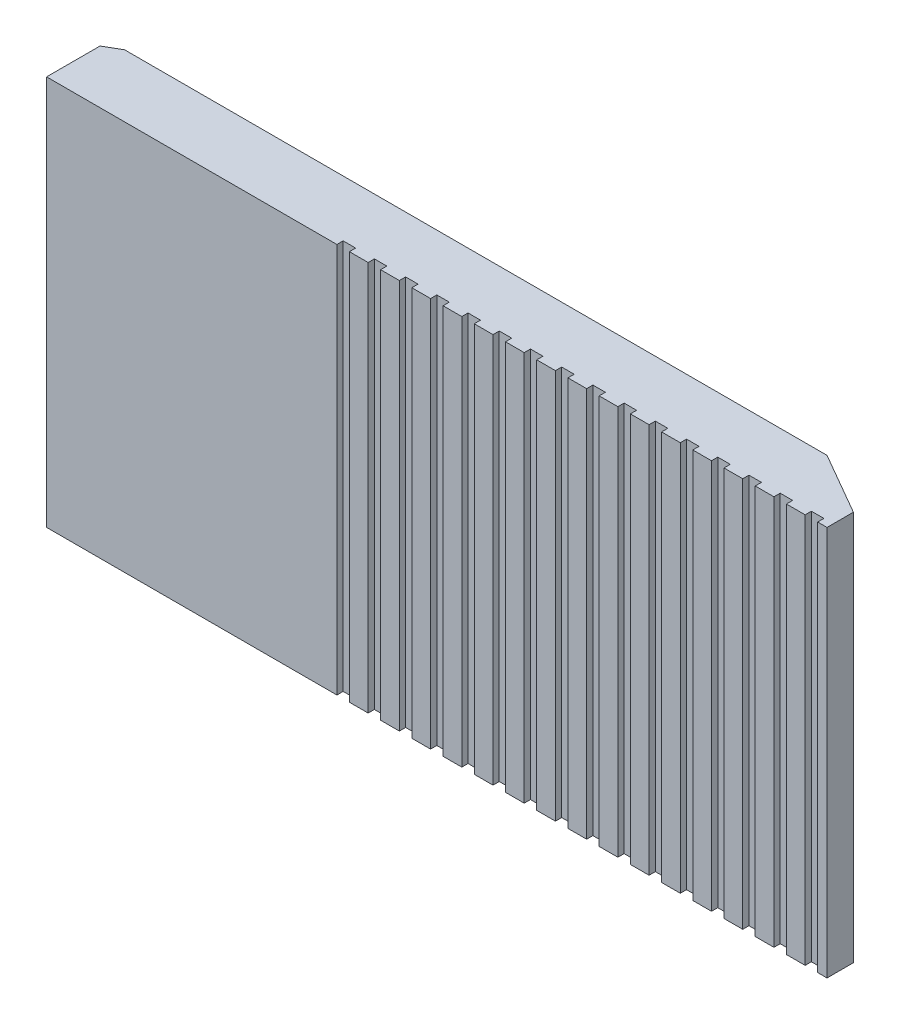
from build123d import *

# Parameters (mm, degrees)
SKETCH1_W           = 50
SKETCH1_H           = 25
BOSS_EXTRUDE1_DEPTH = 4
CHAMFER1_SIZE       = 4
CHAMFER1_SIZE2      = 2.309401077
SKETCH2_W           = 10
SKETCH2_H           = 10
BOSS_EXTRUDE2_DEPTH = 5.5
CUT_EXTRUDE1_REACH  = 37.781
SKETCH3_W           = 0.8
SKETCH3_H           = 0.8
LPATTERN1_COUNT     = 16
LPATTERN1_PITCH     = 2
CHAMFER2_SIZE       = 1
CHAMFER2_SIZE2      = 0.577350269


with BuildPart() as part:
    # Sketch1 → Boss-Extrude1 (new body)
    with BuildSketch(Plane.XY):
        Rectangle(SKETCH1_W, SKETCH1_H)
    extrude(amount=BOSS_EXTRUDE1_DEPTH)

    # Chamfer1
    chamfer1_edges = [part.edges().sort_by_distance(p)[0] for p in [
        (25, 0, 0),
    ]]
    chamfer1_side = [part.faces().sort_by_distance(p)[0] for p in [
        (0, 0, 0),
    ]]
    chamfer(chamfer1_edges, length=CHAMFER1_SIZE, length2=CHAMFER1_SIZE2, reference=chamfer1_side[0])

    # Sketch2 → Boss-Extrude2 (add)
    with BuildSketch(Plane(origin=(0, 0, 0), x_dir=(-1, 0, 0), z_dir=(0, 0, -1))):
        with Locations((-10, 0)):
            Rectangle(SKETCH2_W, SKETCH2_H)
    extrude(amount=BOSS_EXTRUDE2_DEPTH)

    # Sketch3 → Cut-Extrude1 (cut, up to next)
    with BuildSketch(Plane(origin=(0, 12.5, 0), x_dir=(1, 0, 0), z_dir=(0, 1, 0)), mode=Mode.PRIVATE) as cut_extrude1_sk1:
        with Locations((24, -4)):
            Rectangle(SKETCH3_W, SKETCH3_H)
    cut_extrude1_tool1 = extrude(cut_extrude1_sk1.sketch, amount=-CUT_EXTRUDE1_REACH, mode=Mode.PRIVATE) & part.part
    cut_extrude1 = cut_extrude1_tool1.solids().sort_by_distance((24, 12.5, 4))[0]
    add(cut_extrude1, mode=Mode.SUBTRACT)

    # LPattern1: Cut-Extrude1 ×16
    with Locations(*[(-i * LPATTERN1_PITCH, 0, 0) for i in range(1, LPATTERN1_COUNT)]):
        add(cut_extrude1, mode=Mode.SUBTRACT)

    # Chamfer2
    chamfer2_edges = [part.edges().sort_by_distance(p)[0] for p in [
        (-25, 0, 0),
    ]]
    chamfer2_side = [part.faces().sort_by_distance(p)[0] for p in [
        (-3.142857143, 0, 0),
    ]]
    chamfer(chamfer2_edges, length=CHAMFER2_SIZE, length2=CHAMFER2_SIZE2, reference=chamfer2_side[0])


solid = part.part
